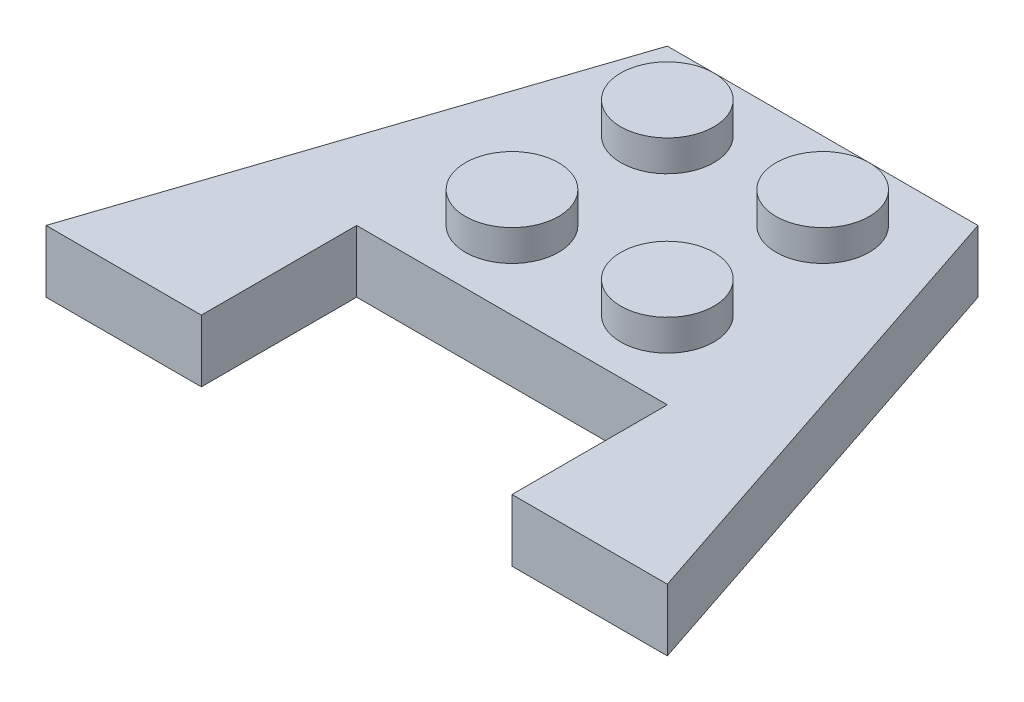
from build123d import *

# Parameters (mm, degrees)
BOSS_EXTRUDE1_DEPTH  = 3.2
SKETCH2_R            = 2.4
BOSS_EXTRUDE2_DEPTH  = 1.6
LPATTERN1_COUNT      = 2
LPATTERN1_PITCH      = 8
LPATTERN1_COUNT_DIR2 = 2
LPATTERN1_PITCH_DIR2 = 8
SHELL1_T             = -1.6


with BuildPart() as part:
    # Sketch1 → Boss-Extrude1 (new body)
    with BuildSketch(Plane(origin=(0, 0, 0), x_dir=(1, 0, 0), z_dir=(0, 1, 0))):
        Polygon((0, 0), (8, 24), (24, 24), (32, 0), (24, 0), (24, 8), (8, 8), (8, 0), align=None)
    extrude(amount=BOSS_EXTRUDE1_DEPTH)

    # Sketch2 → Boss-Extrude2 (add)
    with BuildSketch(Plane(origin=(0, 3.2, 0), x_dir=(1, 0, 0), z_dir=(0, 1, 0))):
        with Locations(Location((12, 20, 0), (0, 0, 270))):
            Circle(SKETCH2_R)
    boss_extrude2 = extrude(amount=BOSS_EXTRUDE2_DEPTH)

    # LPattern1: Boss-Extrude2 2 × 2
    with Locations(*[(i * LPATTERN1_PITCH, 0, j * LPATTERN1_PITCH_DIR2) for i in range(LPATTERN1_COUNT) for j in range(LPATTERN1_COUNT_DIR2) if (i, j) != (0, 0)]):
        add(boss_extrude2)

    # Shell1
    shell1_openings = [part.faces().sort_by_distance(p)[0] for p in [
        (16, 0, -12.571428571),
    ]]
    offset(amount=SHELL1_T, openings=shell1_openings, kind=Kind.INTERSECTION)


solid = part.part
